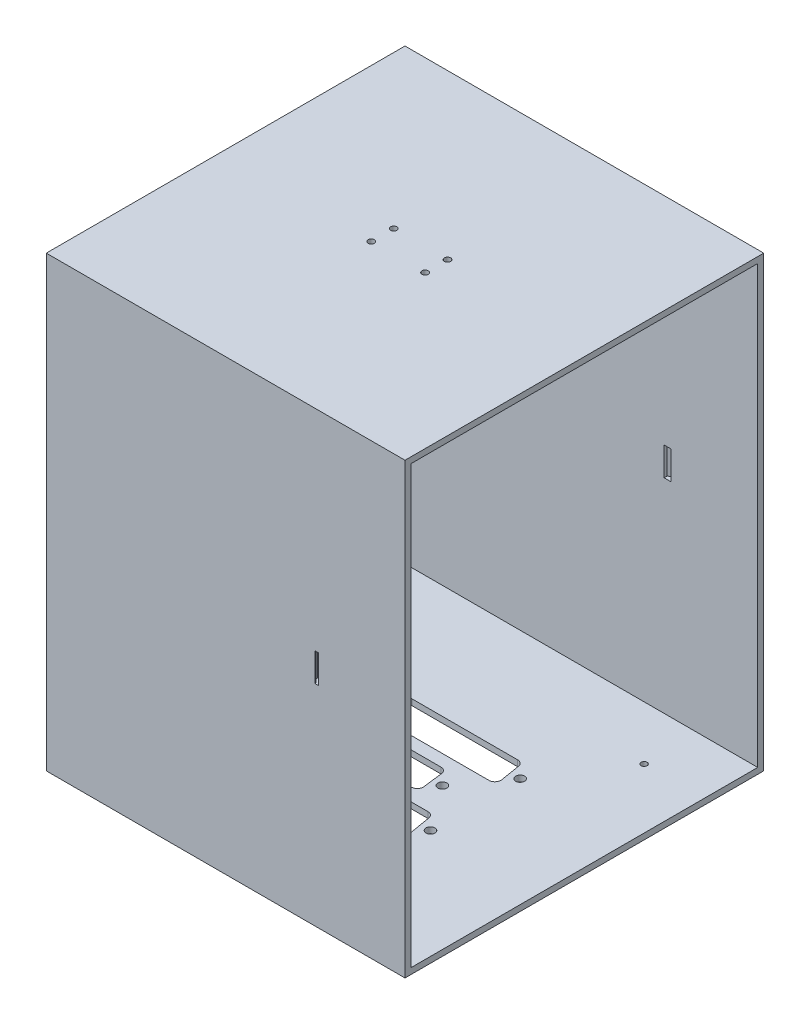
from build123d import *

# Parameters (mm, degrees)
SKETCH1_W             = 120
SKETCH1_H             = 120
MAIN_BODY_DEPTH       = 150
HOLLOW_INSIDE_T       = -2
MAIN_PCB_HOLES_REACH  = 174.337
SKETCH2_R             = 1
LED_PCB_HOLES_REACH   = 174.337
SKETCH3_R             = 1.05
CONNECTOR_SLOTS_REACH = 174.337
SKETCH4_R             = 1.5
CUT_EXTRUDE1_DEPTH    = 4.75


with BuildPart() as part:
    # Sketch1 → Main-Body (new body)
    with BuildSketch(Plane(origin=(0, 0, 0), x_dir=(1, 0, 0), z_dir=(0, 1, 0))):
        Rectangle(SKETCH1_W, SKETCH1_H)
    extrude(amount=MAIN_BODY_DEPTH)

    # Hollow-Inside
    hollow_inside_openings = [part.faces().sort_by_distance(p)[0] for p in [
        (60, 75, 0),
    ]]
    offset(amount=HOLLOW_INSIDE_T, openings=hollow_inside_openings, kind=Kind.INTERSECTION)

    # Sketch2 → Main-PCB-Holes (cut, up to next)
    with BuildSketch(Plane.XZ, mode=Mode.PRIVATE) as main_pcb_holes_sk1:
        with Locations(Location((-40, 40, 0), (0, 0, 270))):
            Circle(SKETCH2_R)
    main_pcb_holes_tool1 = extrude(main_pcb_holes_sk1.sketch, amount=-MAIN_PCB_HOLES_REACH, mode=Mode.PRIVATE) & part.part
    # Sketch2 → Main-PCB-Holes (cut, up to next)
    with BuildSketch(Plane.XZ, mode=Mode.PRIVATE) as main_pcb_holes_sk2:
        with Locations(Location((40, 40, 0), (0, 0, 270))):
            Circle(SKETCH2_R)
    main_pcb_holes_tool2 = extrude(main_pcb_holes_sk2.sketch, amount=-MAIN_PCB_HOLES_REACH, mode=Mode.PRIVATE) & part.part
    # Sketch2 → Main-PCB-Holes (cut, up to next)
    with BuildSketch(Plane.XZ, mode=Mode.PRIVATE) as main_pcb_holes_sk3:
        with Locations(Location((40, -40, 0), (0, 0, 270))):
            Circle(SKETCH2_R)
    main_pcb_holes_tool3 = extrude(main_pcb_holes_sk3.sketch, amount=-MAIN_PCB_HOLES_REACH, mode=Mode.PRIVATE) & part.part
    # Sketch2 → Main-PCB-Holes (cut, up to next)
    with BuildSketch(Plane.XZ, mode=Mode.PRIVATE) as main_pcb_holes_sk4:
        with Locations(Location((-40, -40, 0), (0, 0, 270))):
            Circle(SKETCH2_R)
    main_pcb_holes_tool4 = extrude(main_pcb_holes_sk4.sketch, amount=-MAIN_PCB_HOLES_REACH, mode=Mode.PRIVATE) & part.part
    add(main_pcb_holes_tool1.solids().sort_by_distance((-40, 0, 40))[0], mode=Mode.SUBTRACT)
    add(main_pcb_holes_tool2.solids().sort_by_distance((40, 0, 40))[0], mode=Mode.SUBTRACT)
    add(main_pcb_holes_tool3.solids().sort_by_distance((40, 0, -40))[0], mode=Mode.SUBTRACT)
    add(main_pcb_holes_tool4.solids().sort_by_distance((-40, 0, -40))[0], mode=Mode.SUBTRACT)

    # Sketch3 → LED-PCB-Holes (cut, up to next)
    with BuildSketch(Plane(origin=(0, 150, 0), x_dir=(1, 0, 0), z_dir=(0, 1, 0)), mode=Mode.PRIVATE) as led_pcb_holes_sk1:
        with Locations(Location((-9, 5.23, 0), (0, 0, 270))):
            Circle(SKETCH3_R)
    led_pcb_holes_tool1 = extrude(led_pcb_holes_sk1.sketch, amount=-LED_PCB_HOLES_REACH, mode=Mode.PRIVATE) & part.part
    # Sketch3 → LED-PCB-Holes (cut, up to next)
    with BuildSketch(Plane(origin=(0, 150, 0), x_dir=(1, 0, 0), z_dir=(0, 1, 0)), mode=Mode.PRIVATE) as led_pcb_holes_sk2:
        with Locations(Location((9, 5.23, 0), (0, 0, 270))):
            Circle(SKETCH3_R)
    led_pcb_holes_tool2 = extrude(led_pcb_holes_sk2.sketch, amount=-LED_PCB_HOLES_REACH, mode=Mode.PRIVATE) & part.part
    # Sketch3 → LED-PCB-Holes (cut, up to next)
    with BuildSketch(Plane(origin=(0, 150, 0), x_dir=(1, 0, 0), z_dir=(0, 1, 0)), mode=Mode.PRIVATE) as led_pcb_holes_sk3:
        with Locations(Location((9, -2.27, 0), (0, 0, 270))):
            Circle(SKETCH3_R)
    led_pcb_holes_tool3 = extrude(led_pcb_holes_sk3.sketch, amount=-LED_PCB_HOLES_REACH, mode=Mode.PRIVATE) & part.part
    # Sketch3 → LED-PCB-Holes (cut, up to next)
    with BuildSketch(Plane(origin=(0, 150, 0), x_dir=(1, 0, 0), z_dir=(0, 1, 0)), mode=Mode.PRIVATE) as led_pcb_holes_sk4:
        with Locations(Location((-9, -2.27, 0), (0, 0, 270))):
            Circle(SKETCH3_R)
    led_pcb_holes_tool4 = extrude(led_pcb_holes_sk4.sketch, amount=-LED_PCB_HOLES_REACH, mode=Mode.PRIVATE) & part.part
    add(led_pcb_holes_tool1.solids().sort_by_distance((-9, 150, -5.23))[0], mode=Mode.SUBTRACT)
    add(led_pcb_holes_tool2.solids().sort_by_distance((9, 150, -5.23))[0], mode=Mode.SUBTRACT)
    add(led_pcb_holes_tool3.solids().sort_by_distance((9, 150, 2.27))[0], mode=Mode.SUBTRACT)
    add(led_pcb_holes_tool4.solids().sort_by_distance((-9, 150, 2.27))[0], mode=Mode.SUBTRACT)

    # Sketch4 → Connector-Slots (cut, up to next)
    with BuildSketch(Plane.XZ, mode=Mode.PRIVATE) as connector_slots_sk1:
        with Locations(Location((-12.5, 0, 0), (0, 0, 270))):
            Circle(SKETCH4_R)
    connector_slots_tool1 = extrude(connector_slots_sk1.sketch, amount=-CONNECTOR_SLOTS_REACH, mode=Mode.PRIVATE) & part.part
    # Sketch4 → Connector-Slots (cut, up to next)
    with BuildSketch(Plane.XZ, mode=Mode.PRIVATE) as connector_slots_sk2:
        with Locations(Location((12.5, 0, 0), (0, 0, 270))):
            Circle(SKETCH4_R)
    connector_slots_tool2 = extrude(connector_slots_sk2.sketch, amount=-CONNECTOR_SLOTS_REACH, mode=Mode.PRIVATE) & part.part
    # Sketch4 → Connector-Slots (cut, up to next)
    with BuildSketch(Plane.XZ, mode=Mode.PRIVATE) as connector_slots_sk3:
        with Locations(Location((-23.52, -15, 0), (0, 0, 270))):
            Circle(SKETCH4_R)
    connector_slots_tool3 = extrude(connector_slots_sk3.sketch, amount=-CONNECTOR_SLOTS_REACH, mode=Mode.PRIVATE) & part.part
    # Sketch4 → Connector-Slots (cut, up to next)
    with BuildSketch(Plane.XZ, mode=Mode.PRIVATE) as connector_slots_sk4:
        with Locations(Location((23.52, -15, 0), (0, 0, 270))):
            Circle(SKETCH4_R)
    connector_slots_tool4 = extrude(connector_slots_sk4.sketch, amount=-CONNECTOR_SLOTS_REACH, mode=Mode.PRIVATE) & part.part
    # Sketch4 → Connector-Slots (cut, up to next)
    with BuildSketch(Plane.XZ, mode=Mode.PRIVATE) as connector_slots_sk5:
        with Locations(Location((-23.52, 15, 0), (0, 0, 270))):
            Circle(SKETCH4_R)
    connector_slots_tool5 = extrude(connector_slots_sk5.sketch, amount=-CONNECTOR_SLOTS_REACH, mode=Mode.PRIVATE) & part.part
    # Sketch4 → Connector-Slots (cut, up to next)
    with BuildSketch(Plane.XZ, mode=Mode.PRIVATE) as connector_slots_sk6:
        with Locations(Location((23.52, 15, 0), (0, 0, 270))):
            Circle(SKETCH4_R)
    connector_slots_tool6 = extrude(connector_slots_sk6.sketch, amount=-CONNECTOR_SLOTS_REACH, mode=Mode.PRIVATE) & part.part
    # Sketch4 → Connector-Slots (cut, up to next)
    with BuildSketch(Plane.XZ, mode=Mode.PRIVATE) as connector_slots_sk7:
        with BuildLine():
            Line((-6.891594987, -5.117891943), (6.891594987, -5.117891943))
            ThreePointArc((6.891594987, -5.117891943), (8.211781315, -4.620259427), (8.875, -3.375))
            Line((8.875, -3.375), (9.75, 3.375))
            ThreePointArc((9.75, 3.375), (9.268962471, 4.952294386), (7.766594987, 5.632108057))
            Line((7.766594987, 5.632108057), (-7.766594987, 5.632108057))
            ThreePointArc((-7.766594987, 5.632108057), (-9.268962471, 4.952294386), (-9.75, 3.375))
            Line((-9.75, 3.375), (-8.875, -3.375))
            ThreePointArc((-8.875, -3.375), (-8.211781315, -4.620259427), (-6.891594987, -5.117891943))
        make_face()
    connector_slots_tool7 = extrude(connector_slots_sk7.sketch, amount=-CONNECTOR_SLOTS_REACH, mode=Mode.PRIVATE) & part.part
    # Sketch4 → Connector-Slots (cut, up to next)
    with BuildSketch(Plane.XZ, mode=Mode.PRIVATE) as connector_slots_sk8:
        with BuildLine():
            Line((-17.652212152, -20.046202025), (17.652212152, -20.046202025))
            ThreePointArc((17.652212152, -20.046202025), (18.944961945, -19.57224199), (19.625, -18.375))
            Line((19.625, -18.375), (20.75, -11.625))
            ThreePointArc((20.75, -11.625), (20.303252117, -10.003452233), (18.777212152, -9.296202025))
            Line((18.777212152, -9.296202025), (-18.777212152, -9.296202025))
            ThreePointArc((-18.777212152, -9.296202025), (-20.303252117, -10.003452233), (-20.75, -11.625))
            Line((-20.75, -11.625), (-19.625, -18.375))
            ThreePointArc((-19.625, -18.375), (-18.944961945, -19.57224199), (-17.652212152, -20.046202025))
        make_face()
    connector_slots_tool8 = extrude(connector_slots_sk8.sketch, amount=-CONNECTOR_SLOTS_REACH, mode=Mode.PRIVATE) & part.part
    # Sketch4 → Connector-Slots (cut, up to next)
    with BuildSketch(Plane.XZ, mode=Mode.PRIVATE) as connector_slots_sk9:
        with BuildLine():
            Line((-17.652212152, 9.953797975), (17.652212152, 9.953797975))
            ThreePointArc((17.652212152, 9.953797975), (18.944961945, 10.42775801), (19.625, 11.625))
            Line((19.625, 11.625), (20.75, 18.375))
            ThreePointArc((20.75, 18.375), (20.303252117, 19.996547767), (18.777212152, 20.703797975))
            Line((18.777212152, 20.703797975), (-18.777212152, 20.703797975))
            ThreePointArc((-18.777212152, 20.703797975), (-20.303252117, 19.996547767), (-20.75, 18.375))
            Line((-20.75, 18.375), (-19.625, 11.625))
            ThreePointArc((-19.625, 11.625), (-18.944961945, 10.42775801), (-17.652212152, 9.953797975))
        make_face()
    connector_slots_tool9 = extrude(connector_slots_sk9.sketch, amount=-CONNECTOR_SLOTS_REACH, mode=Mode.PRIVATE) & part.part
    add(connector_slots_tool1.solids().sort_by_distance((-12.5, 0, 0))[0], mode=Mode.SUBTRACT)
    add(connector_slots_tool2.solids().sort_by_distance((12.5, 0, 0))[0], mode=Mode.SUBTRACT)
    add(connector_slots_tool3.solids().sort_by_distance((-23.52, 0, -15))[0], mode=Mode.SUBTRACT)
    add(connector_slots_tool4.solids().sort_by_distance((23.52, 0, -15))[0], mode=Mode.SUBTRACT)
    add(connector_slots_tool5.solids().sort_by_distance((-23.52, 0, 15))[0], mode=Mode.SUBTRACT)
    add(connector_slots_tool6.solids().sort_by_distance((23.52, 0, 15))[0], mode=Mode.SUBTRACT)
    add(connector_slots_tool7.solids().sort_by_distance((0, 0, 0.368259))[0], mode=Mode.SUBTRACT)
    add(connector_slots_tool8.solids().sort_by_distance((0, 0, -14.605881))[0], mode=Mode.SUBTRACT)
    add(connector_slots_tool9.solids().sort_by_distance((0, 0, 15.394119))[0], mode=Mode.SUBTRACT)

    # Sketch12 → Cut-Extrude1 (cut, symmetric)
    with BuildSketch(Plane(origin=(0, 75, 0), x_dir=(1, 0, 0), z_dir=(0, 1, 0))):
        Polygon((30.88, 60), (29.88, 60), (29.88, 59.702820323), (28.68, 59.01), (28.68, 58), (30.88, 58), (31, 58), (31, 60), align=None)
    cut_extrude1 = extrude(amount=CUT_EXTRUDE1_DEPTH, both=True, mode=Mode.SUBTRACT)

    # Mirror1: Cut-Extrude1 across plane
    add(cut_extrude1.mirror(Plane.XY), mode=Mode.SUBTRACT)


solid = part.part
